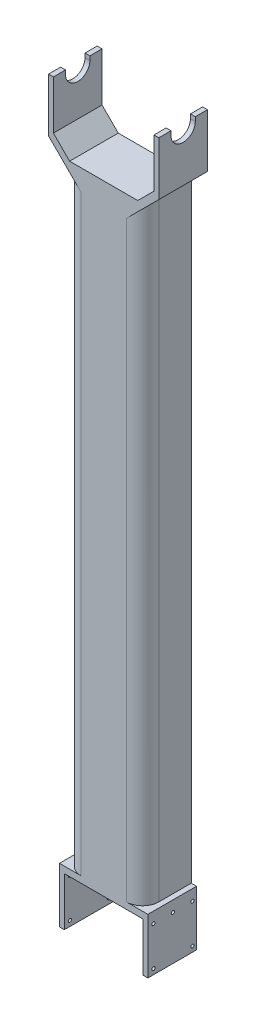
from build123d import *

# Parameters (mm, degrees)
SKETCH2_W               = 32
SKETCH2_H               = 30
SKETCH2_W_2             = 15
BOSS_EXTRUDE1_DEPTH     = 3
SKETCH4_W               = 3
SKETCH4_H               = 30
BOSS_EXTRUDE2_DEPTH     = 3
SKETCH5_W               = 3
SKETCH5_H               = 30
BOSS_EXTRUDE3_DEPTH     = 40
CUT_EXTRUDE1_DEPTH      = 82.841309862
CUT_EXTRUDE1_DEPTH_BACK = 82.841309862
CHAMFER1_SIZE           = 10
BOSS_EXTRUDE4_DEPTH     = 375
FILLET2_R               = 10
SKETCH8_W               = 54.5
SKETCH8_H               = 30
BOSS_EXTRUDE5_DEPTH     = 4
SKETCH9_W               = 3
SKETCH9_H               = 30
BOSS_EXTRUDE6_DEPTH     = 30
CUT_EXTRUDE2_DEPTH      = 414.833625156
CUT_EXTRUDE2_DEPTH_BACK = 414.833625156
SKETCH10_R              = 1


with BuildPart() as part:
    # Sketch2 → Boss-Extrude1 (new body)
    with BuildSketch(Plane(origin=(0, 0, 0), x_dir=(1, 0, 0), z_dir=(0, 1, 0))):
        Rectangle(SKETCH2_W, SKETCH2_H)
        with Locations((-23.5, 0)):
            Rectangle(SKETCH2_W_2, SKETCH2_H)
        with Locations((23.5, 0)):
            Rectangle(SKETCH2_W_2, SKETCH2_H)
    extrude(amount=BOSS_EXTRUDE1_DEPTH)

    # Sketch4 → Boss-Extrude2 (add)
    with BuildSketch(Plane(origin=(0, 3, 0), x_dir=(1, 0, 0), z_dir=(0, 1, 0))):
        with Locations((-32.5, 0)):
            Rectangle(SKETCH4_W, SKETCH4_H)
        with Locations((32.5, 0)):
            Rectangle(SKETCH4_W, SKETCH4_H)
    extrude(amount=-BOSS_EXTRUDE2_DEPTH)

    # Sketch5 → Boss-Extrude3 (add)
    with BuildSketch(Plane(origin=(0, 3, 0), x_dir=(1, 0, 0), z_dir=(0, 1, 0))):
        with Locations((-32.5, 0)):
            Rectangle(SKETCH5_W, SKETCH5_H)
        with Locations((32.5, 0)):
            Rectangle(SKETCH5_W, SKETCH5_H)
    extrude(amount=BOSS_EXTRUDE3_DEPTH)

    # Sketch6 → Cut-Extrude1 (cut, two sides: drawn at the far end of the back side and taken through both)
    with BuildSketch(Plane.ZY.offset(34).offset(-CUT_EXTRUDE1_DEPTH_BACK)):
        with BuildLine():
            Line((-7.5, 45.5), (7.5, 45.5))
            Line((7.5, 45.5), (7.5, 40.5))
            ThreePointArc((7.5, 40.5), (0, 33), (-7.5, 40.5))
            Line((-7.5, 40.5), (-7.5, 45.5))
        make_face()
    extrude(amount=CUT_EXTRUDE1_DEPTH + CUT_EXTRUDE1_DEPTH_BACK, mode=Mode.SUBTRACT)

    # Chamfer1
    chamfer1_edges = [part.edges().sort_by_distance(p)[0] for p in [
        (-34, 0, 0),
        (34, 0, 0),
        (-31, 3, 0),
        (31, 3, 0),
    ]]
    chamfer(chamfer1_edges, length=CHAMFER1_SIZE)

    # Sketch7 → Boss-Extrude4 (add)
    with BuildSketch(Plane.XZ):
        Polygon((-24, 15), (24, 15), (24, -15.023541852), (19, -15.023541852), (19, 10), (-19, 10), (-19, -15.023541852), (-24, -15.023541852), align=None)
    extrude(amount=BOSS_EXTRUDE4_DEPTH)

    # Fillet2
    fillet2_edges = [part.edges().sort_by_distance(p)[0] for p in [
        (24, -187.5, 15),
        (-24, -187.5, 15),
    ]]
    fillet(fillet2_edges, radius=FILLET2_R)

    # Sketch8 → Boss-Extrude5 (add)
    with BuildSketch(Plane.XZ.offset(375)):
        Rectangle(SKETCH8_W, SKETCH8_H)
    extrude(amount=BOSS_EXTRUDE5_DEPTH)

    # Sketch9 → Boss-Extrude6 (add)
    with BuildSketch(Plane.XZ.offset(379)):
        with Locations((-25.75, 0)):
            Rectangle(SKETCH9_W, SKETCH9_H)
        with Locations((25.75, 0)):
            Rectangle(SKETCH9_W, SKETCH9_H)
    extrude(amount=BOSS_EXTRUDE6_DEPTH)

    # Sketch10 → Cut-Extrude2 (cut, two sides: drawn at the far end of the back side and taken through both)
    with BuildSketch(Plane.ZY.offset(27.25).offset(-CUT_EXTRUDE2_DEPTH_BACK)):
        with Locations((-12.451139345, -405.721121856)):
            Circle(SKETCH10_R)
        with Locations((11.548860655, -405.721121856)):
            Circle(SKETCH10_R)
        with Locations((-12.451139345, -381.721121856)):
            Circle(SKETCH10_R)
        with Locations((11.548860655, -381.721121856)):
            Circle(SKETCH10_R)
        with Locations((-0.451139345, -381.721121856)):
            Circle(SKETCH10_R)
    extrude(amount=CUT_EXTRUDE2_DEPTH + CUT_EXTRUDE2_DEPTH_BACK, mode=Mode.SUBTRACT)


solid = part.part
